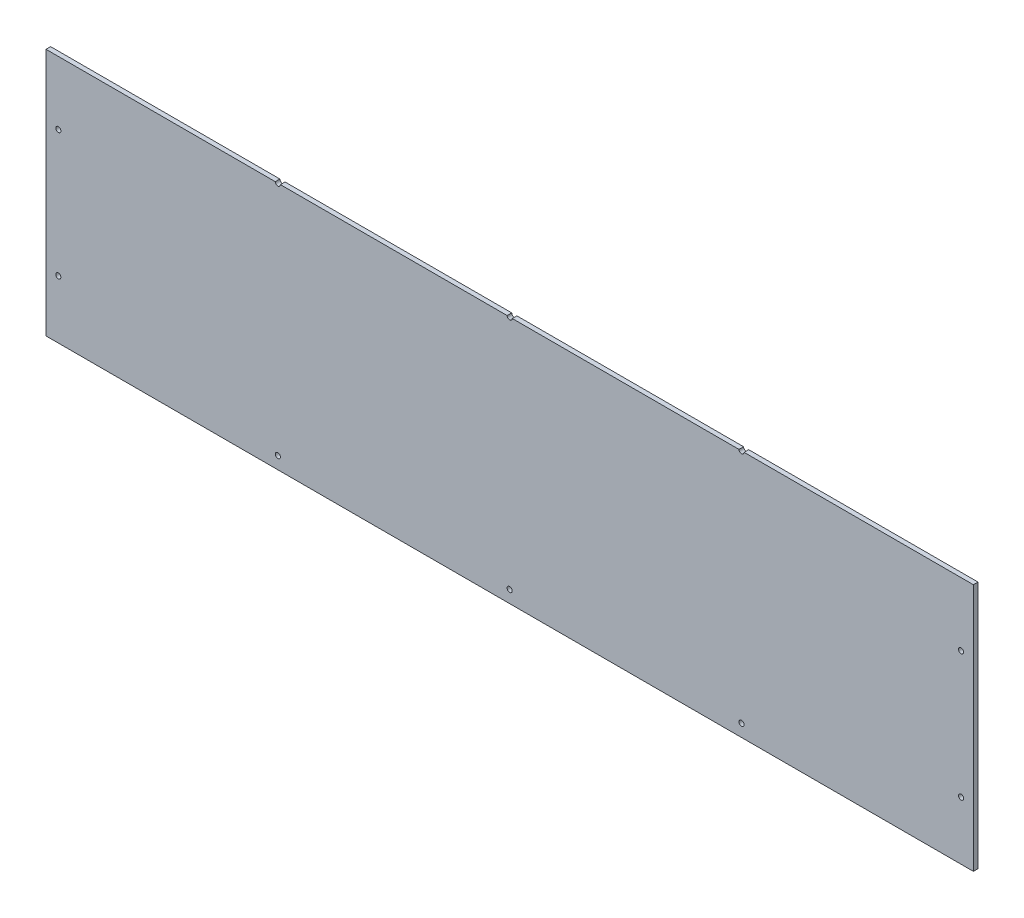
from build123d import *

# Parameters (mm, degrees)
SKETCH1_R           = 2.5
BOSS_EXTRUDE1_DEPTH = 4.5


with BuildPart() as part:
    # Sketch1 → Boss-Extrude1 (new body)
    with BuildSketch(Plane.XY):
        with BuildLine():
            Line((-452, 123.5), (-452, -118.5))
            Line((-452, -118.5), (452, -118.5))
            Line((452, -118.5), (452, 123.5))
            Line((452, 123.5), (228.5, 123.5))
            ThreePointArc((228.5, 123.5), (226, 121), (223.5, 123.5))
            Line((223.5, 123.5), (2.5, 123.5))
            ThreePointArc((2.5, 123.5), (0, 121), (-2.5, 123.5))
            Line((-2.5, 123.5), (-223.5, 123.5))
            ThreePointArc((-223.5, 123.5), (-226, 121), (-228.5, 123.5))
            Line((-228.5, 123.5), (-452, 123.5))
        make_face()
        with Locations((-440, 61.75)):
            Circle(SKETCH1_R, mode=Mode.SUBTRACT)
        with Locations((-440, -61.75)):
            Circle(SKETCH1_R, mode=Mode.SUBTRACT)
        with Locations(Location((440, -61.75, 0), (0, 0, 180))):
            Circle(SKETCH1_R, mode=Mode.SUBTRACT)
        with Locations(Location((440, 61.75, 0), (0, 0, 180))):
            Circle(SKETCH1_R, mode=Mode.SUBTRACT)
        with Locations((0, -106.5)):
            Circle(SKETCH1_R, mode=Mode.SUBTRACT)
        with Locations((226, -106.5)):
            Circle(SKETCH1_R, mode=Mode.SUBTRACT)
        with Locations((-226, -106.5)):
            Circle(SKETCH1_R, mode=Mode.SUBTRACT)
    extrude(amount=BOSS_EXTRUDE1_DEPTH)


solid = part.part
